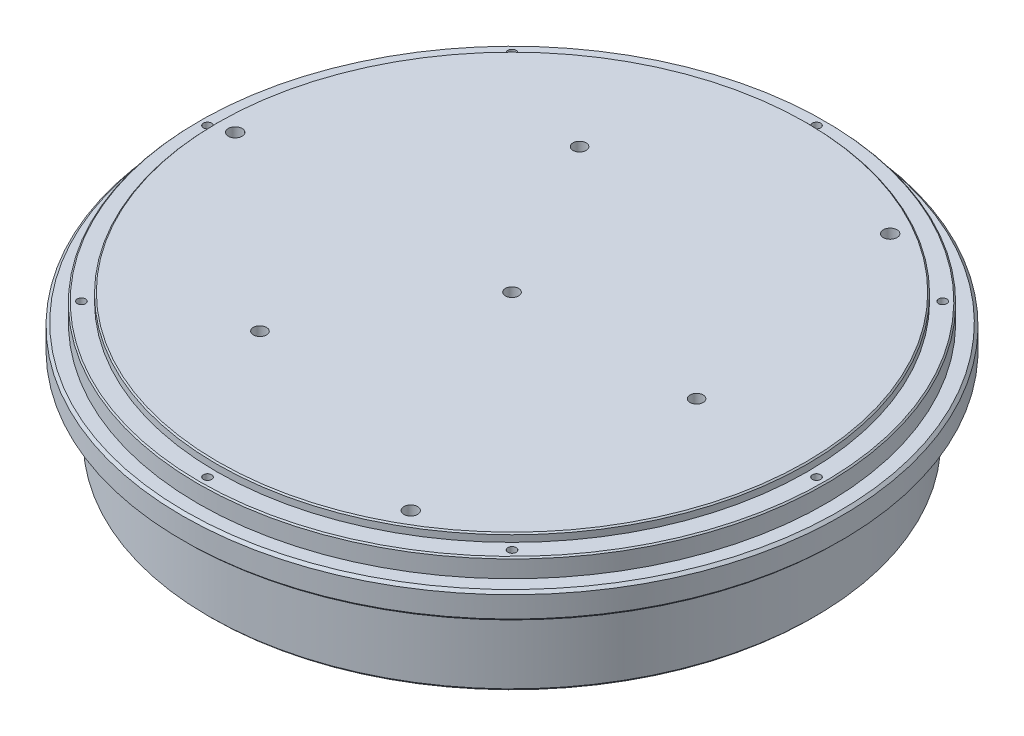
from build123d import *

# Parameters (mm, degrees)
SKETCH1_R                      = 125
BOSS_EXTRUDE1_DEPTH            = 50
SKETCH2_R                      = 127
SKETCH2_R_2                    = 119
PAKNING_DEPTH                  = 10
PAKNINGSRING_START             = -3
SKETCH3_R                      = 125
SKETCH3_R_2                    = 112
PAKNINGSRING_DEPTH             = 3
SKETCH7_R                      = 135
SKETCH7_R_2                    = 115
CUT_EXTRUDE6_DEPTH             = 30
CHAMFER2_SIZE                  = 0.5
CIRPATTERN2_COUNT              = 8
SKETCH19_R                     = 11
SPINDLE_DEPTH                  = 15.5
CIRPATTERN4_COUNT              = 3
F_10_0_10_DIAMETER_HOLE2_D     = 10
F_10_0_10_DIAMETER_HOLE2_DEPTH = 40.5
F_10_0_10_DIAMETER_HOLE2_TIP   = 3.004303095
F_5_0_5_DIAMETER_HOLE2_D       = 5
F_5_0_5_DIAMETER_HOLE2_DEPTH   = 10
F_5_0_5_DIAMETER_HOLE2_TIP     = 1.502151548
F_5_0_5_DIAMETER_HOLE3_D       = 5
F_5_0_5_DIAMETER_HOLE3_DEPTH   = 20.5
F_5_0_5_DIAMETER_HOLE3_TIP     = 1.502151548
M4_TAPPED_HOLE1_AT_2_COUNT     = 2
M4_TAPPED_HOLE1_AT_2_PITCH     = 19
M4_TAPPED_HOLE2_D              = 3.3
M4_TAPPED_HOLE2_DEPTH          = 10.1
M4_TAPPED_HOLE2_TIP            = 0.991420021
M4_TAPPED_HOLE3_D              = 3.3
M4_TAPPED_HOLE3_DEPTH          = 10.1
M4_TAPPED_HOLE3_TIP            = 0.991420021
CIRPATTERN8_COUNT              = 3
CIRPATTERN9_COUNT              = 3
CHAMFER3_SIZE                  = 1


with BuildPart() as part:
    # Sketch1 → Boss-Extrude1 (new body)
    with BuildSketch(Plane(origin=(0, 0, 0), x_dir=(1, 0, 0), z_dir=(0, 1, 0))):
        with Locations(Location((0, 0, 0), (0, 0, 270))):
            Circle(SKETCH1_R)
    extrude(amount=BOSS_EXTRUDE1_DEPTH)

    # Sketch2 → Pakning (cut)
    with BuildSketch(Plane(origin=(0, 50, 0), x_dir=(1, 0, 0), z_dir=(0, 1, 0))):
        Circle(SKETCH2_R)
        with Locations(Location((0, 0, 0), (0, 0, 270))):
            Circle(SKETCH2_R_2, mode=Mode.SUBTRACT)
    extrude(amount=-PAKNING_DEPTH, mode=Mode.SUBTRACT)

    # Sketch3 → PakningsRing (cut)
    with BuildSketch(Plane(origin=(0, 50, 0), x_dir=(1, 0, 0), z_dir=(0, 1, 0)).offset(PAKNINGSRING_START)):
        with Locations(Location((0, 0, 0), (0, 0, 270))):
            Circle(SKETCH3_R)
        with Locations(Location((0, 0, 0), (0, 0, 270))):
            Circle(SKETCH3_R_2, mode=Mode.SUBTRACT)
    extrude(amount=PAKNINGSRING_DEPTH, mode=Mode.SUBTRACT)

    # Sketch7 → Cut-Extrude6 (cut)
    with BuildSketch(Plane.XZ):
        Circle(SKETCH7_R)
        with Locations(Location((0, 0, 0), (0, 0, 270))):
            Circle(SKETCH7_R_2, mode=Mode.SUBTRACT)
    extrude(amount=-CUT_EXTRUDE6_DEPTH, mode=Mode.SUBTRACT)

    # Chamfer2
    chamfer2_edges = [part.edges().sort_by_distance(p)[0] for p in [
        (0, 47, -119),
        (0, 50, -112),
    ]]
    chamfer(chamfer2_edges, length=CHAMFER2_SIZE)

    # Sketch17 → Tapped Hole for M3x0.5 Helicoil1 (revolve, cut)
    with BuildSketch(Plane(origin=(0, 47, -115.5), x_dir=(0, 0, 1), z_dir=(1, 0, 0))):
        Polygon((0, 0), (0, 5.946355475), (1.575, 5), (1.575, 0), align=None)
    tapped_hole_for_m3x0_5_helicoil1 = revolve(axis=Axis((0, 53.35, -115.5), (0, -1, 0)), mode=Mode.SUBTRACT)

    # CirPattern2: Tapped Hole for M3x0.5 Helicoil1 ×8 about axis
    cirpattern2_axis = Axis((0, 0, 0), (0, 1, 0))
    for i in range(1, CIRPATTERN2_COUNT):
        add(tapped_hole_for_m3x0_5_helicoil1.rotate(cirpattern2_axis, i * 360 / CIRPATTERN2_COUNT), mode=Mode.SUBTRACT)

    # Sketch19 → Spindle (cut)
    with BuildSketch(Plane.XZ):
        with Locations(Location((-80, 0, 0), (0, 0, 270))):
            Circle(SKETCH19_R)
    spindle = extrude(amount=-SPINDLE_DEPTH, mode=Mode.SUBTRACT)

    # CirPattern4: Spindle ×3 about axis
    cirpattern4_axis = Axis((0, 0, 0), (0, 1, 0))
    for i in range(1, CIRPATTERN4_COUNT):
        add(spindle.rotate(cirpattern4_axis, i * 360 / CIRPATTERN4_COUNT), mode=Mode.SUBTRACT)

    # Sketch27 → Ø10.0 (10) Diameter Hole1 (revolve, cut)
    with BuildSketch(Plane(origin=(-35, 0, 60.621778265), x_dir=(0, 0, -1), z_dir=(1, 0, 0))):
        Polygon((0, 0), (0, 43.504303095), (5, 40.5), (5, 0), align=None)
    f_10_0_10_diameter_hole1 = revolve(axis=Axis((-35, -6.35, 60.621778265), (0, 1, 0)), mode=Mode.SUBTRACT)

    # Ø10.0 (10) Diameter Hole2
    with Locations(Plane(origin=(0, 0, 0), x_dir=(-1, 0, 0), z_dir=(0, -1, 0))):
        with Locations((0, 0)):
            Hole(F_10_0_10_DIAMETER_HOLE2_D / 2, depth=F_10_0_10_DIAMETER_HOLE2_DEPTH)
            with Locations((0, 0, -(F_10_0_10_DIAMETER_HOLE2_DEPTH + F_10_0_10_DIAMETER_HOLE2_TIP / 2))):  # 118° drill point
                Cone(0, F_10_0_10_DIAMETER_HOLE2_D / 2, F_10_0_10_DIAMETER_HOLE2_TIP, mode=Mode.SUBTRACT)

    # Sketch31 → Ø5.0 (5) Diameter Hole1 (revolve, cut)
    with BuildSketch(Plane(origin=(-35, 50, 60.621778265), x_dir=(0, 0, 1), z_dir=(1, 0, 0))):
        Polygon((0, 0), (0, 11.502151548), (2.5, 10), (2.5, 0), align=None)
    f_5_0_5_diameter_hole1 = revolve(axis=Axis((-35, 56.35, 60.621778265), (0, -1, 0)), mode=Mode.SUBTRACT)

    # Ø5.0 (5) Diameter Hole2
    with Locations(Plane(origin=(0, 50, 0), x_dir=(1, 0, 0), z_dir=(0, 1, 0))):
        with Locations((0, 0)):
            Hole(F_5_0_5_DIAMETER_HOLE2_D / 2, depth=F_5_0_5_DIAMETER_HOLE2_DEPTH)
            with Locations((0, 0, -(F_5_0_5_DIAMETER_HOLE2_DEPTH + F_5_0_5_DIAMETER_HOLE2_TIP / 2))):  # 118° drill point
                Cone(0, F_5_0_5_DIAMETER_HOLE2_D / 2, F_5_0_5_DIAMETER_HOLE2_TIP, mode=Mode.SUBTRACT)

    # Ø5.0 (5) Diameter Hole3
    with Locations(Plane(origin=(0, 0, 0), x_dir=(-1, 0, 0), z_dir=(0, -1, 0))):
        with Locations((-20, -34.641016151)):
            Hole(F_5_0_5_DIAMETER_HOLE3_D / 2, depth=F_5_0_5_DIAMETER_HOLE3_DEPTH)
            with Locations((0, 0, -(F_5_0_5_DIAMETER_HOLE3_DEPTH + F_5_0_5_DIAMETER_HOLE3_TIP / 2))):  # 118° drill point
                Cone(0, F_5_0_5_DIAMETER_HOLE3_D / 2, F_5_0_5_DIAMETER_HOLE3_TIP, mode=Mode.SUBTRACT)

    # Sketch37 → M4 Tapped Hole1 (revolve, cut)
    with BuildSketch(Plane(origin=(-43.227241336, 0, 55.871778265), x_dir=(0, 0, -1), z_dir=(1, 0, 0))):
        Polygon((0, 0), (0, 11.091420021), (1.65, 10.1), (1.65, 0), align=None)
    m4_tapped_hole1 = revolve(axis=Axis((-43.227241336, -6.35, 55.871778265), (0, 1, 0)), mode=Mode.SUBTRACT)

    # M4 Tapped Hole1 at 2: M4 Tapped Hole1 ×2
    with Locations(*[Vector(0.8660254037844363, 0, 0.5000000000000042) * (i * M4_TAPPED_HOLE1_AT_2_PITCH) for i in range(1, M4_TAPPED_HOLE1_AT_2_COUNT)]):
        add(m4_tapped_hole1, mode=Mode.SUBTRACT)

    # M4 Tapped Hole2
    with Locations(Plane(origin=(0, 0, 0), x_dir=(-1, 0, 0), z_dir=(0, -1, 0))):
        with Locations((8.227241336, -4.75), (-8.227241336, 4.75)):
            Hole(M4_TAPPED_HOLE2_D / 2, depth=M4_TAPPED_HOLE2_DEPTH)
            with Locations((0, 0, -(M4_TAPPED_HOLE2_DEPTH + M4_TAPPED_HOLE2_TIP / 2))):  # 118° drill point
                Cone(0, M4_TAPPED_HOLE2_D / 2, M4_TAPPED_HOLE2_TIP, mode=Mode.SUBTRACT)

    # M4 Tapped Hole3
    with Locations(Plane(origin=(0, 0, 0), x_dir=(-1, 0, 0), z_dir=(0, -1, 0))):
        with Locations((-13.504809472, -38.391016151), (-26.495190528, -30.891016151)):
            Hole(M4_TAPPED_HOLE3_D / 2, depth=M4_TAPPED_HOLE3_DEPTH)
            with Locations((0, 0, -(M4_TAPPED_HOLE3_DEPTH + M4_TAPPED_HOLE3_TIP / 2))):  # 118° drill point
                Cone(0, M4_TAPPED_HOLE3_D / 2, M4_TAPPED_HOLE3_TIP, mode=Mode.SUBTRACT)

    # Sketch43 → Tapped Hole for M5x0.8 Helicoil1 (revolve, cut)
    with BuildSketch(Plane(origin=(52.5, 50, -90.932667397), x_dir=(0, 0, 1), z_dir=(1, 0, 0))):
        Polygon((0, 0), (0, 9.762237609), (2.6, 8.2), (2.6, 0), align=None)
    tapped_hole_for_m5x0_8_helicoil1 = revolve(axis=Axis((52.5, 56.35, -90.932667397), (0, -1, 0)), mode=Mode.SUBTRACT)

    # CirPattern8: Tapped Hole for M5x0.8 Helicoil1 ×3 about axis
    cirpattern8_axis = Axis((0, 0, 0), (0, 1, 0))
    for i in range(1, CIRPATTERN8_COUNT):
        add(tapped_hole_for_m5x0_8_helicoil1.rotate(cirpattern8_axis, i * 360 / CIRPATTERN8_COUNT), mode=Mode.SUBTRACT)

    # CirPattern9: Ø10.0 (10) Diameter Hole1, Ø5.0 (5) Diameter Hole1, M4 Tapped Hole1 ×3 about axis
    cirpattern9_axis = Axis((0, 0, 0), (0, 1, 0))
    add([f_10_0_10_diameter_hole1.rotate(cirpattern9_axis, i * 360 / CIRPATTERN9_COUNT) for i in range(1, CIRPATTERN9_COUNT)], mode=Mode.SUBTRACT)
    add([f_5_0_5_diameter_hole1.rotate(cirpattern9_axis, i * 360 / CIRPATTERN9_COUNT) for i in range(1, CIRPATTERN9_COUNT)], mode=Mode.SUBTRACT)
    add([m4_tapped_hole1.rotate(cirpattern9_axis, i * 360 / CIRPATTERN9_COUNT) for i in range(1, CIRPATTERN9_COUNT)], mode=Mode.SUBTRACT)

    # CirPattern9 copy 1 sketch → CirPattern9 copy 1 (revolve, cut)
    with BuildSketch(Plane(origin=(70, 0, -9.5), x_dir=(-0.8660254037844387, 0, 0.4999999999999998), z_dir=(-0.4999999999999998, 0, -0.8660254037844387))):
        Polygon((0, 0), (0, 11.091420021), (1.65, 10.1), (1.65, 0), align=None)
    revolve(axis=Axis((70, -6.35, -9.5), (0, 1, 0)), mode=Mode.SUBTRACT)

    # CirPattern9 copy 2 sketch → CirPattern9 copy 2 (revolve, cut)
    with BuildSketch(Plane(origin=(-43.227241336, 0, -55.871778265), x_dir=(0.8660254037844384, 0, 0.5000000000000004), z_dir=(-0.5000000000000004, 0, 0.8660254037844384))):
        Polygon((0, 0), (0, 11.091420021), (1.65, 10.1), (1.65, 0), align=None)
    revolve(axis=Axis((-43.227241336, -6.35, -55.871778265), (0, 1, 0)), mode=Mode.SUBTRACT)

    # Chamfer3
    chamfer3_edges = [part.edges().sort_by_distance(p)[0] for p in [
        (0, 30, -125),
        (0, 0, 115),
        (0, 40, -125),
    ]]
    chamfer(chamfer3_edges, length=CHAMFER3_SIZE)


solid = part.part
